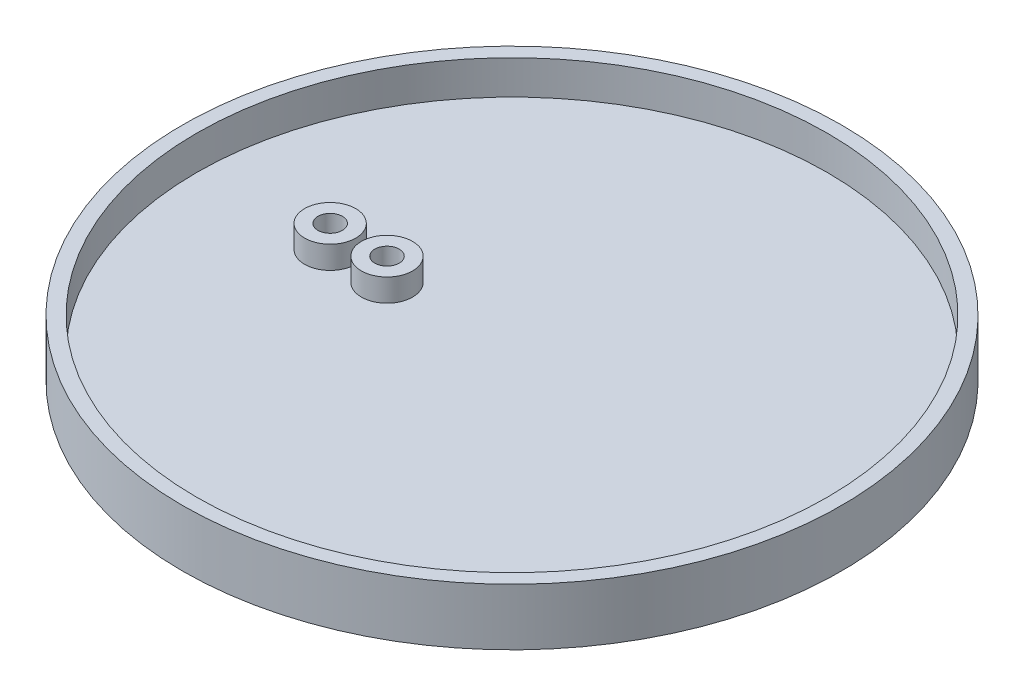
from build123d import *

# Parameters (mm, degrees)
SKETCH_1_R                       = 4.5
MOVING_POST_A_DEPTH              = 8
SKETCH_2_R                       = 58
CUP_PLATE_D116_T4_DEPTH          = 4
SKETCH_3_R                       = 4.5
MOVING_POST_B_DEPTH              = 8
SKETCH_4_R                       = 58
SKETCH_4_R_2                     = 55.5
DRIP_SKIRT_OD116_ID111_H10_DEPTH = 10
SKETCH_5_R                       = 2.15
M4_MOVING_MOUNT_CLEARANCE_DEPTH  = 8


with BuildPart() as part:
    # 草图1 → Moving_post_A (new body)
    with BuildSketch(Plane(origin=(0, 0, 0), x_dir=(1, 0, 0), z_dir=(0, 1, 0))):
        with Locations(Location((-22, 0, 0), (0, 0, 270))):
            Circle(SKETCH_1_R)
    extrude(amount=MOVING_POST_A_DEPTH)

    # 草图2 → Cup_plate_D116_T4 (add)
    with BuildSketch(Plane(origin=(0, 0, 0), x_dir=(1, 0, 0), z_dir=(0, 1, 0))):
        with Locations(Location((0, 0, 0), (0, 0, 270))):
            Circle(SKETCH_2_R)
    extrude(amount=CUP_PLATE_D116_T4_DEPTH)

    # 草图3 → Moving_post_B (add)
    with BuildSketch(Plane(origin=(0, 0, 0), x_dir=(1, 0, 0), z_dir=(0, 1, 0))):
        with Locations(Location((-32, 0, 0), (0, 0, 270))):
            Circle(SKETCH_3_R)
    extrude(amount=MOVING_POST_B_DEPTH)

    # 草图4 → Drip_skirt_OD116_ID111_H10 (add)
    with BuildSketch(Plane(origin=(0, 0, 0), x_dir=(1, 0, 0), z_dir=(0, 1, 0))):
        with Locations(Location((0, 0, 0), (0, 0, 270))):
            Circle(SKETCH_4_R)
        with Locations(Location((0, 0, 0), (0, 0, 270))):
            Circle(SKETCH_4_R_2, mode=Mode.SUBTRACT)
    extrude(amount=DRIP_SKIRT_OD116_ID111_H10_DEPTH)

    # 草图5 → M4_moving_mount_clearance (cut)
    with BuildSketch(Plane(origin=(0, 0, 0), x_dir=(1, 0, 0), z_dir=(0, 1, 0))):
        with Locations(Location((-22, 0, 0), (0, 0, 270))):
            Circle(SKETCH_5_R)
        with Locations(Location((-32, 0, 0), (0, 0, 270))):
            Circle(SKETCH_5_R)
    extrude(amount=M4_MOVING_MOUNT_CLEARANCE_DEPTH, mode=Mode.SUBTRACT)


solid = part.part
